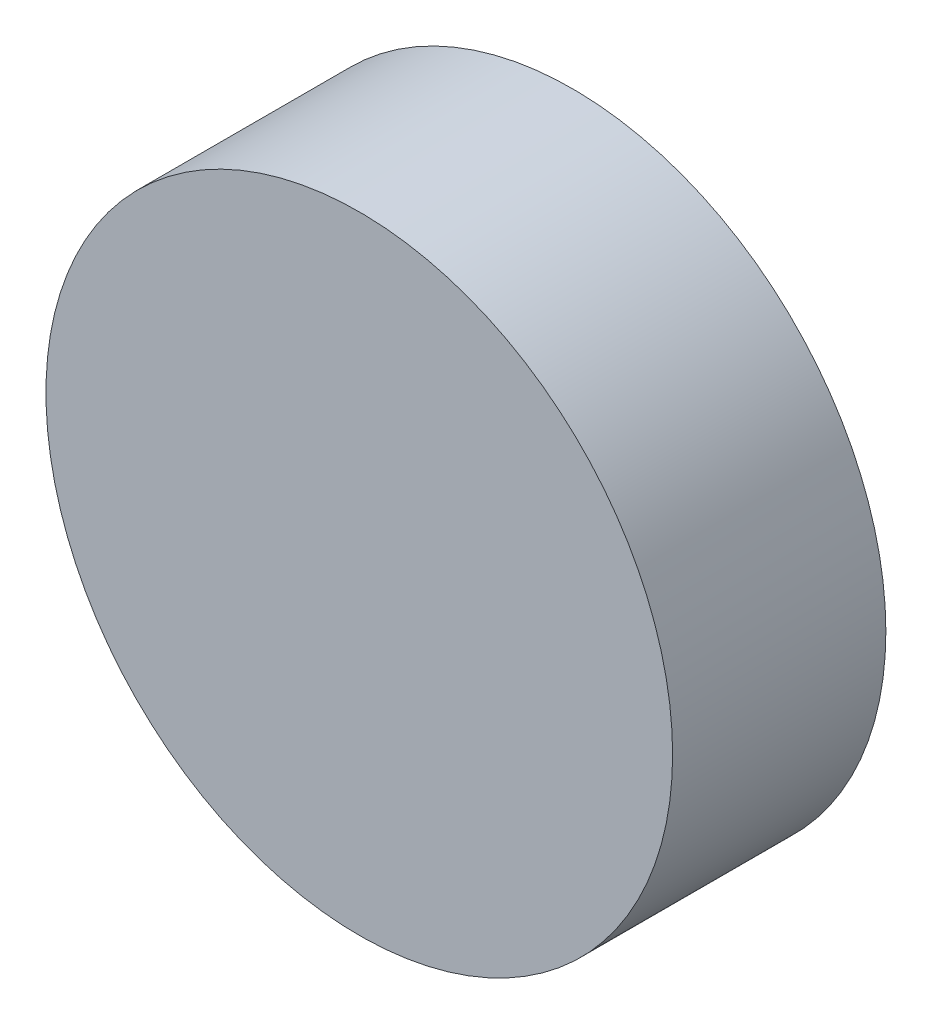
from build123d import *

# Parameters (mm, degrees)
CURVESKETCH_R   = 17.237
CURVEBOSS_DEPTH = 11.731


with BuildPart() as part:
    # CurveSketch → CurveBoss (new body)
    with BuildSketch(Plane.XY):
        with Locations((-3.719, 5.173)):
            Circle(CURVESKETCH_R)
    extrude(amount=CURVEBOSS_DEPTH)


solid = part.part
